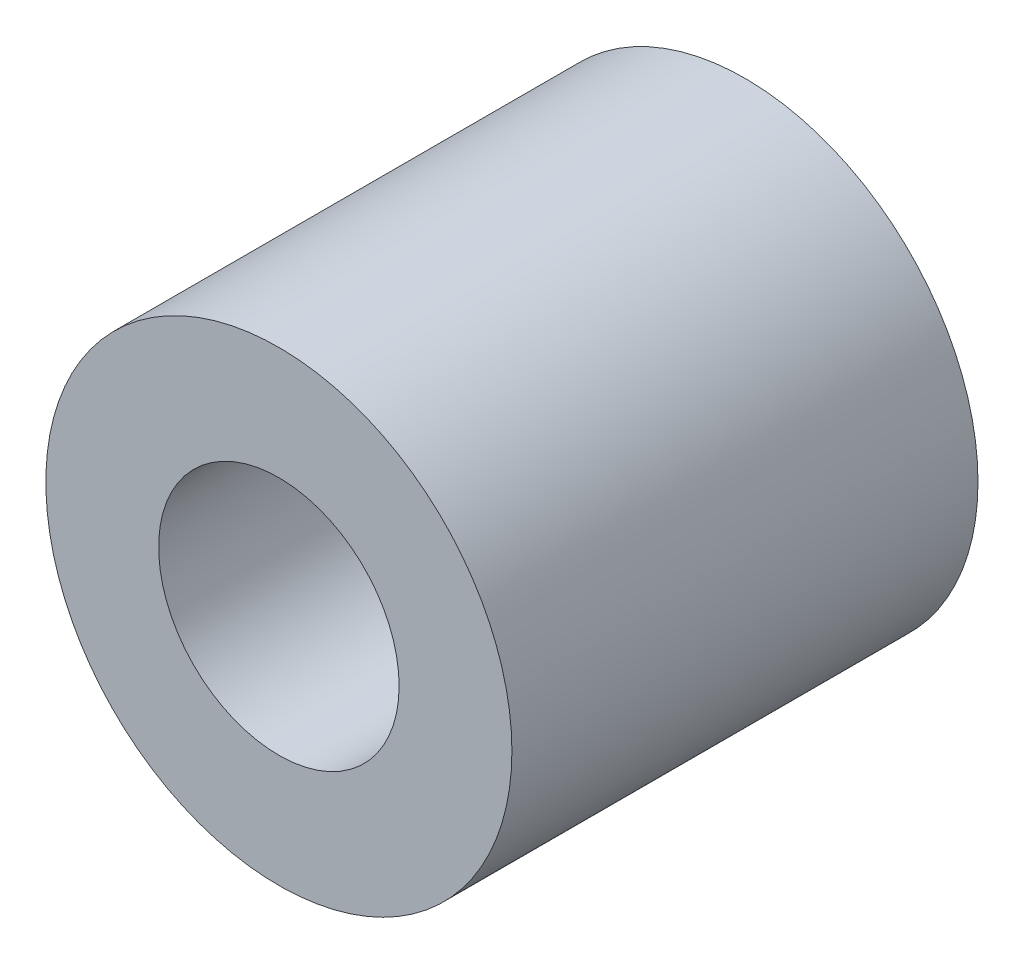
from build123d import *

# Parameters (mm, degrees)
SKETCH1_R      = 3.175
SKETCH1_R_2    = 1.6383
EXTRUDE1_DEPTH = 3.175


with BuildPart() as part:
    # Sketch1 → Extrude1 (new, symmetric)
    with BuildSketch(Plane.XY):
        Circle(SKETCH1_R)
        Circle(SKETCH1_R_2, mode=Mode.SUBTRACT)
    extrude(amount=EXTRUDE1_DEPTH, both=True)


solid = part.part
